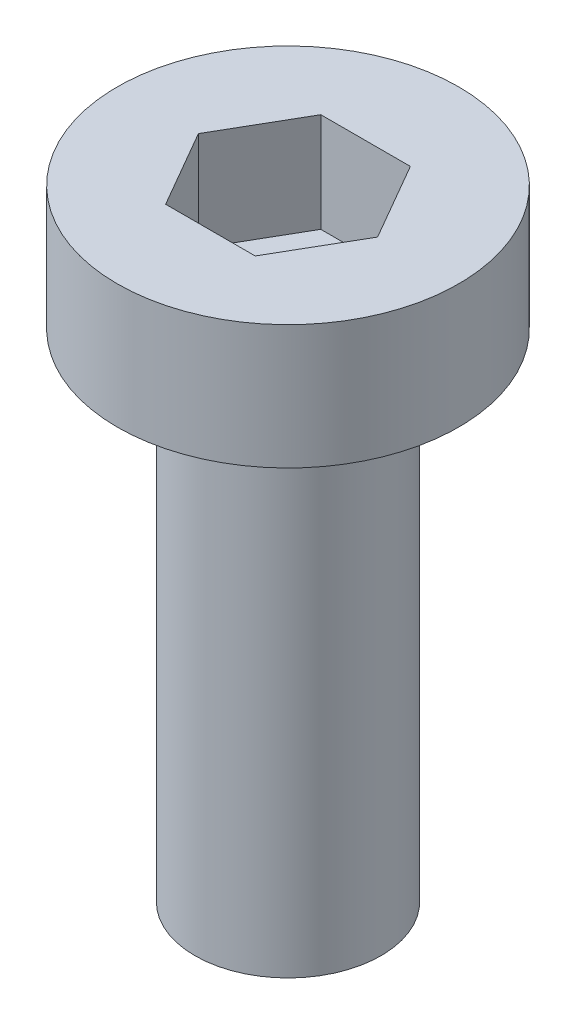
from build123d import *

# Parameters (mm, degrees)
SKETCH_1_R          = 2.75
EXTRUDE_399_DEPTH   = 2
SKETCH_1_3_R        = 1.5
EXTRUDE_434_DEPTH   = 8
CUT_EXTRUDE_1_DEPTH = 1.6


with BuildPart() as part:
    # 草图1 → Extrude 399 (new body)
    with BuildSketch(Plane(origin=(0, 0, 0), x_dir=(1, 0, 0), z_dir=(0, 1, 0))):
        Circle(SKETCH_1_R)
    extrude(amount=EXTRUDE_399_DEPTH)

    # 草图1<3> → Extrude 434 (add)
    with BuildSketch(Plane(origin=(0, 0, 0), x_dir=(1, 0, 0), z_dir=(0, 1, 0))):
        Circle(SKETCH_1_3_R)
    extrude(amount=-EXTRUDE_434_DEPTH)

    # 草图2 → 切除-拉伸1 (cut)
    with BuildSketch(Plane(origin=(0, 2, 0), x_dir=(1, 0, 0), z_dir=(0, 1, 0))):
        Polygon((1.443375673, 0), (0.721687836, 1.25), (-0.721687836, 1.25), (-1.443375673, 0), (-0.721687836, -1.25), (0.721687836, -1.25), align=None)
    extrude(amount=-CUT_EXTRUDE_1_DEPTH, mode=Mode.SUBTRACT)


solid = part.part
